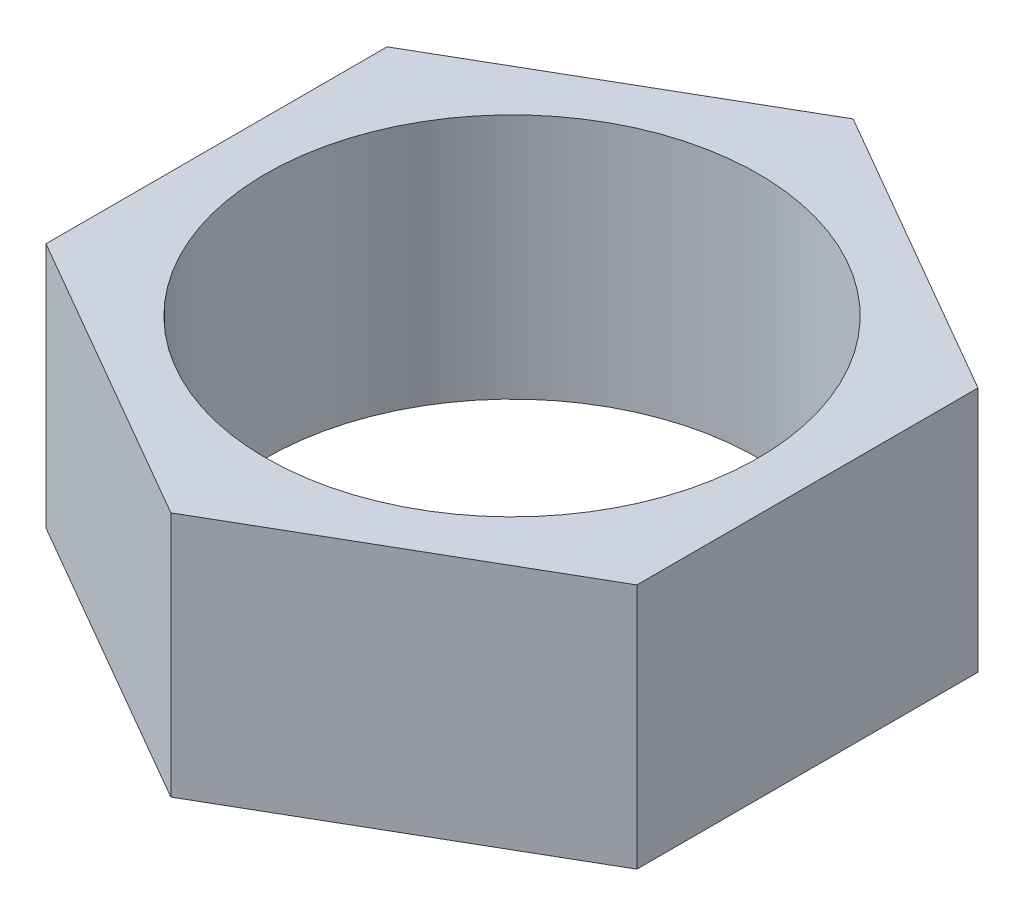
from build123d import *

# Parameters (mm, degrees)
BOSS_EXTRUDE1_DEPTH = 0.25
SKETCH2_R           = 0.25
CUT_EXTRUDE1_DEPTH  = 0.25


with BuildPart() as part:
    # Sketch1 → Boss-Extrude1 (new body)
    with BuildSketch(Plane(origin=(0, 0, 0), x_dir=(1, 0, 0), z_dir=(0, 1, 0))):
        Polygon((-0.3, 0.173205081), (-0.3, -0.173205081), (0, -0.346410162), (0.3, -0.173205081), (0.3, 0.173205081), (0, 0.346410162), align=None)
    extrude(amount=BOSS_EXTRUDE1_DEPTH)

    # Sketch2 → Cut-Extrude1 (cut)
    with BuildSketch(Plane(origin=(0, 0.25, 0), x_dir=(1, 0, 0), z_dir=(0, 1, 0))):
        with Locations(Location((0, 0, 0), (0, 0, 270))):
            Circle(SKETCH2_R)
    extrude(amount=-CUT_EXTRUDE1_DEPTH, mode=Mode.SUBTRACT)


solid = part.part
